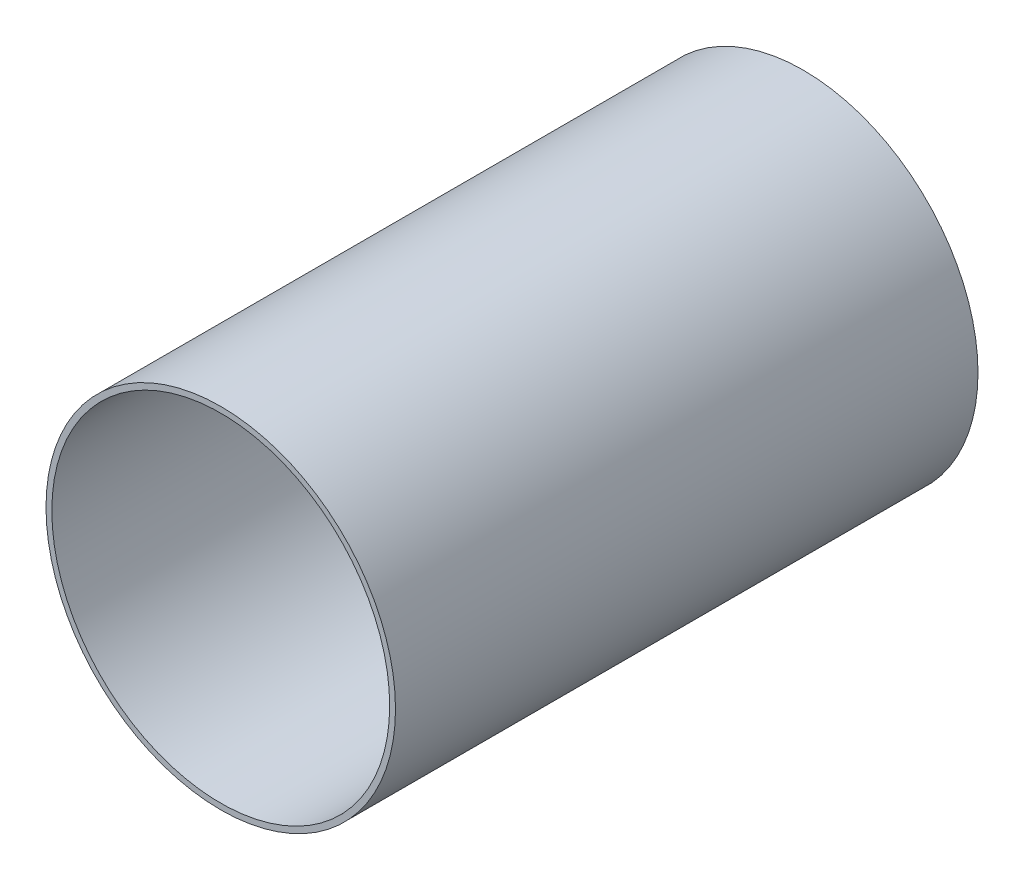
from build123d import *

# Parameters (mm, degrees)
SKETCH1_R           = 1.5
SKETCH1_R_2         = 1.45
BOSS_EXTRUDE1_DEPTH = 5


with BuildPart() as part:
    # Sketch1 → Boss-Extrude1 (new body)
    with BuildSketch(Plane.XY):
        Circle(SKETCH1_R)
        Circle(SKETCH1_R_2, mode=Mode.SUBTRACT)
    extrude(amount=BOSS_EXTRUDE1_DEPTH)


solid = part.part
